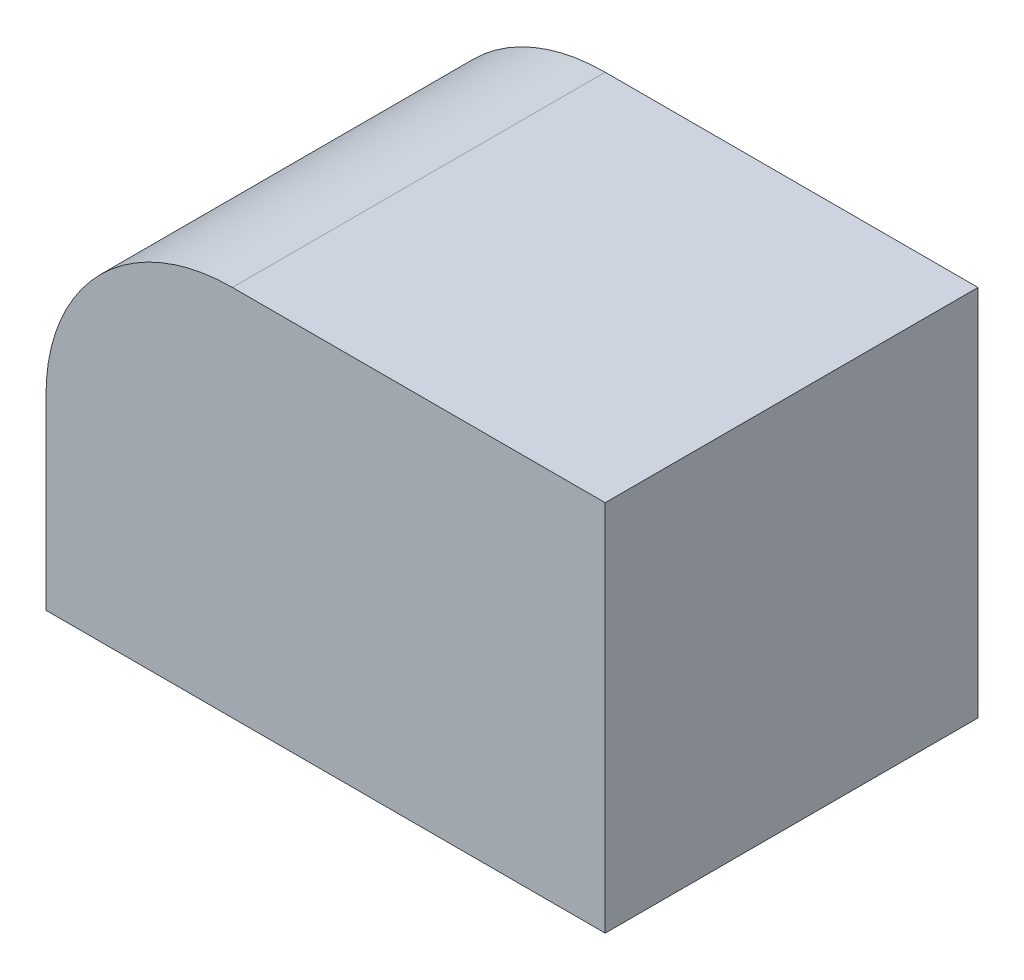
from build123d import *

# Parameters (mm, degrees)
SKETCH1_W           = 60
SKETCH1_H           = 40
BOSS_EXTRUDE1_DEPTH = 40
FILLET1_R           = 20


with BuildPart() as part:
    # Sketch1 → Boss-Extrude1 (new body)
    with BuildSketch(Plane(origin=(0, 0, 0), x_dir=(1, 0, 0), z_dir=(0, 1, 0))):
        Rectangle(SKETCH1_W, SKETCH1_H)
    extrude(amount=BOSS_EXTRUDE1_DEPTH)

    # Fillet1
    fillet1_edges = [part.edges().sort_by_distance(p)[0] for p in [
        (-30, 40, 0),
    ]]
    fillet(fillet1_edges, radius=FILLET1_R)


solid = part.part
